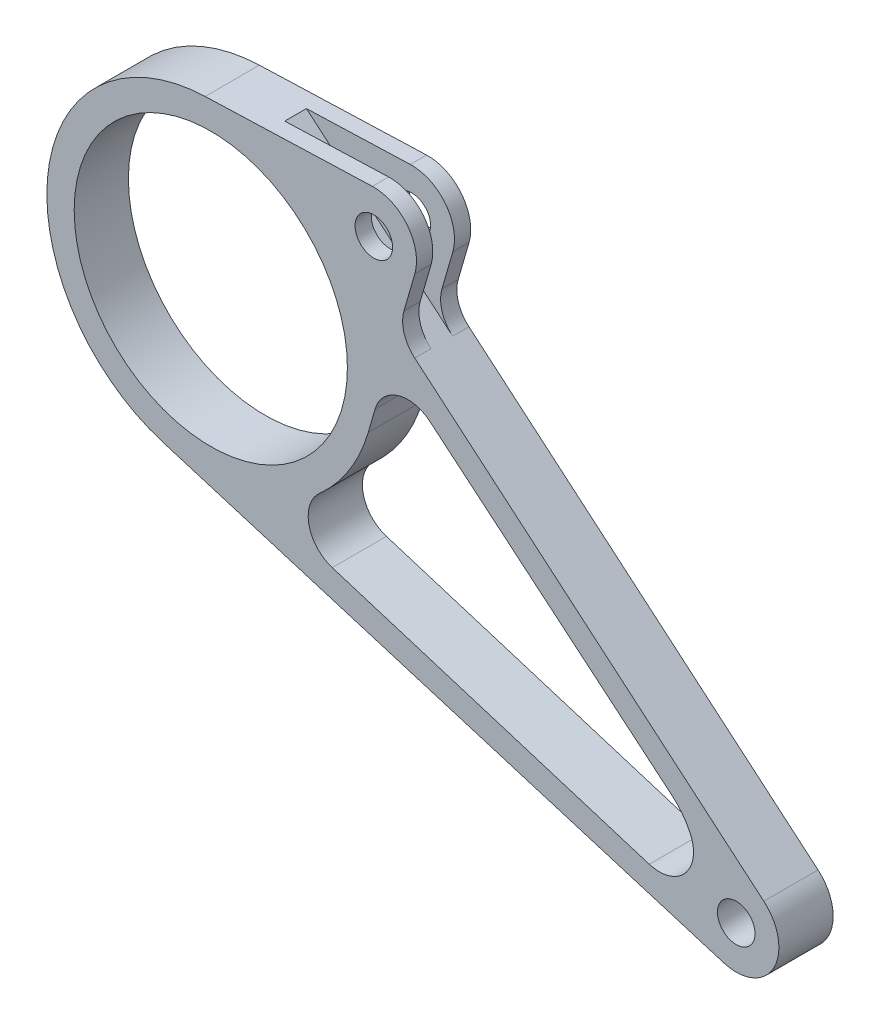
from build123d import *

# Parameters (mm, degrees)
SKETCH4_R           = 40
SKETCH4_R_2         = 5.5
BOSS_EXTRUDE1_DEPTH = 15.875
SKETCH5_R           = 5.5
CUT_EXTRUDE2_DEPTH  = 265.729718277
FILLET1_R           = 10
FILLET2_R           = 20
FILLET3_R           = 10
CUT_EXTRUDE3_DEPTH  = 3.175


with BuildPart() as part:
    # Sketch4 → Boss-Extrude1 (new body)
    with BuildSketch(Plane.XY):
        with BuildLine():
            Line((-142.633865887, -146.080164327), (21.544941406, -195.965223983))
            ThreePointArc((21.544941406, -195.965223983), (33.862932788, -192.99616638), (37.258075063, -180.78874144))
            Line((37.258075063, -180.78874144), (-7.649527095, -12.138772571))
            ThreePointArc((-7.649527095, -12.138772571), (-14.239674224, -4.124786339), (-24.611636772, -3.848367419))
            Line((-24.611636772, -3.848367419), (-147.429933804, -55.967315581))
            ThreePointArc((-147.429933804, -55.967315581), (-176.611366682, -102.704491033), (-142.633865887, -146.080164327))
        make_face()
        with Locations((-128.679206861, -100.153402069)):
            Circle(SKETCH4_R, mode=Mode.SUBTRACT)
        with Locations((25.178967194, -184.005129645)):
            Circle(SKETCH4_R_2, mode=Mode.SUBTRACT)
        with Locations((-19.728634964, -15.355160776)):
            Circle(SKETCH4_R_2, mode=Mode.SUBTRACT)
    extrude(amount=BOSS_EXTRUDE1_DEPTH)

    # Sketch5 → Cut-Extrude2 (cut, through all)
    # profile 1 of 3: a face of its own
    with BuildSketch(Plane.XY.offset(15.875)):
        with BuildLine():
            ThreePointArc((-147.429933804, -55.967315581), (-139.051950222, -53.287570217), (-130.325634952, -52.181647103))
            Line((-130.325634952, -52.181647103), (-81.364667563, -50.50126847))
            ThreePointArc((-81.364667563, -50.50126847), (-71.071592766, -55.316332604), (-68.930846466, -66.476504497))
            Line((-68.930846466, -66.476504497), (-73.912035736, -83.647480421))
            Line((-73.912035736, -83.647480421), (33.260347587, -174.468815318))
            ThreePointArc((33.260347587, -174.468815318), (35.742900566, -177.322816295), (37.258075063, -180.78874144))
            Line((37.258075063, -180.78874144), (-7.649527095, -12.138772571))
            ThreePointArc((-7.649527095, -12.138772571), (-14.239674224, -4.124786339), (-24.611636772, -3.848367419))
            Line((-24.611636772, -3.848367419), (-147.429933804, -55.967315581))
        make_face()
        with Locations((-19.728634964, -15.355160776)):
            Circle(SKETCH5_R, mode=Mode.SUBTRACT)
    # profile 2 of 3: a face of its own
    with BuildSketch(Plane.XY.offset(15.875)):
        with BuildLine():
            Line((20.104564205, -172.581450977), (-76.29204815, -91.851773341))
            Line((-76.29204815, -91.851773341), (-82.579761939, -113.52655345))
            ThreePointArc((-82.579761939, -113.52655345), (-94.695070233, -134.05146186), (-115.189187477, -146.218783616))
            Line((-115.189187477, -146.218783616), (12.828423676, -185.932323147))
            ThreePointArc((12.828423676, -185.932323147), (14.203146627, -178.023377153), (20.104564205, -172.581450977))
        make_face()
    # profile 3 of 3: a face of its own
    with BuildSketch(Plane.XY.offset(15.875)):
        with Locations((-80.935910248, -62.993912992)):
            Circle(SKETCH5_R)
    extrude(amount=-CUT_EXTRUDE2_DEPTH, mode=Mode.SUBTRACT)

    # Fillet1
    fillet1_edges = [part.edges().sort_by_distance(p)[0] for p in [
        (-73.912035736, -83.647480421, 7.9375),
        (-115.189187477, -146.218783616, 7.9375),
        (-76.29204815, -91.851773341, 7.9375),
    ]]
    fillet(fillet1_edges, radius=FILLET1_R)

    # Fillet2
    fillet2_edges = [part.edges().sort_by_distance(p)[0] for p in [
        (20.104564205, -172.581450977, 7.9375),
    ]]
    fillet(fillet2_edges, radius=FILLET2_R)

    # Fillet3
    fillet3_edges = [part.edges().sort_by_distance(p)[0] for p in [
        (12.828423676, -185.932323147, 7.9375),
    ]]
    fillet(fillet3_edges, radius=FILLET3_R)

    # Sketch9 → Cut-Extrude3 (cut, symmetric)
    with BuildSketch(Plane.XY.offset(7.9375)):
        Polygon((-61.249571306, -94.378061257), (-111.793381856, -51.545605705), (-96.460931355, -33.452772516), (-45.917120805, -76.285228067), align=None)
    extrude(amount=CUT_EXTRUDE3_DEPTH, both=True, mode=Mode.SUBTRACT)


solid = part.part
